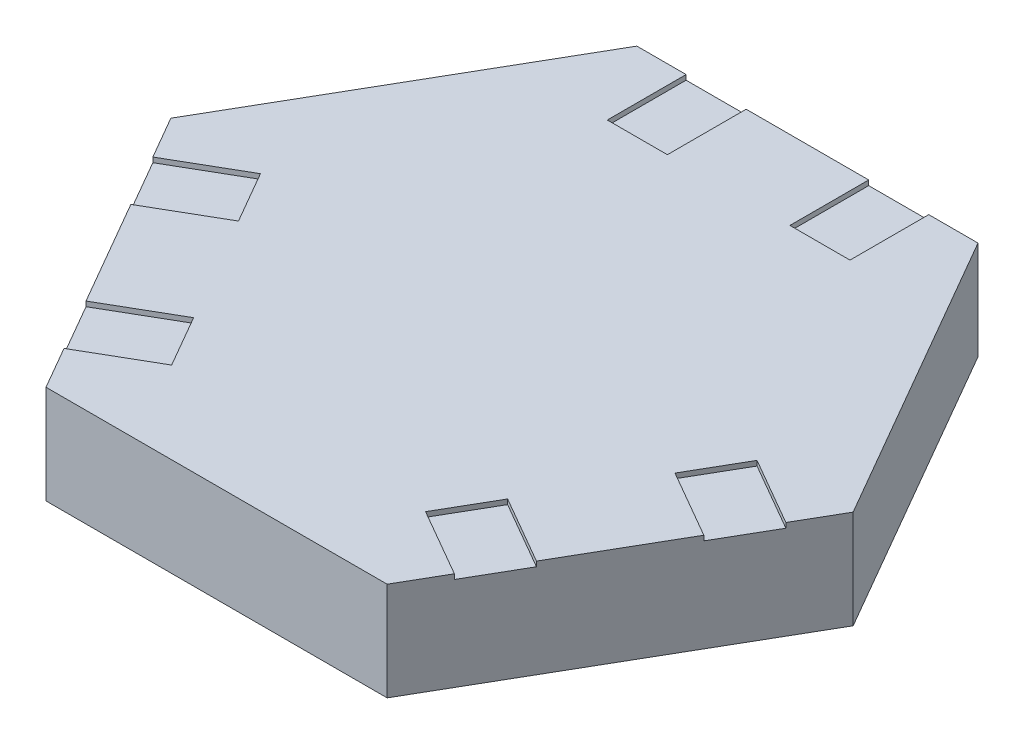
from build123d import *

# Parameters (mm, degrees)
BOSS_EXTRUDE1_DEPTH = 20
SKETCH2_W           = 12.2
SKETCH2_H           = 16
CUT_EXTRUDE1_DEPTH  = 1


with BuildPart() as part:
    # Sketch1 → Boss-Extrude1 (new body)
    with BuildSketch(Plane(origin=(0, 0, 0), x_dir=(1, 0, 0), z_dir=(0, 1, 0))):
        Polygon((69.282032303, 0), (34.641016151, 60), (-34.641016151, 60), (-69.282032303, 0), (-34.641016151, -60), (34.641016151, -60), align=None)
    extrude(amount=BOSS_EXTRUDE1_DEPTH)

    # Sketch2 → Cut-Extrude1 (cut)
    with BuildSketch(Plane(origin=(0, 20, 0), x_dir=(1, 0, 0), z_dir=(0, 1, 0))):
        with Locations((-18.541016151, 52)):
            Rectangle(SKETCH2_W, SKETCH2_H)
        with Locations((18.541016151, 52)):
            Rectangle(SKETCH2_W, SKETCH2_H)
        Polygon((64.282032303, -8.660254038), (50.425625842, -0.660254038), (44.325625842, -11.225763964), (58.182032303, -19.225763964), align=None)
        Polygon((45.741016151, -40.774236036), (31.884609691, -32.774236036), (25.784609691, -43.339745962), (39.641016151, -51.339745962), align=None)
        Polygon((-39.641016151, -51.339745962), (-25.784609691, -43.339745962), (-31.884609691, -32.774236036), (-45.741016151, -40.774236036), align=None)
        Polygon((-58.182032303, -19.225763964), (-44.325625842, -11.225763964), (-50.425625842, -0.660254038), (-64.282032303, -8.660254038), align=None)
    extrude(amount=-CUT_EXTRUDE1_DEPTH, mode=Mode.SUBTRACT)


solid = part.part
